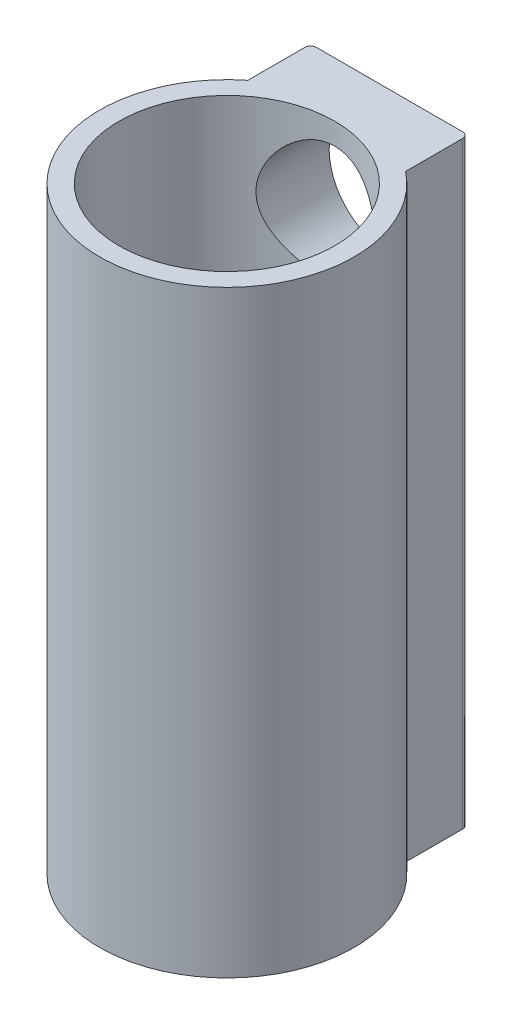
from build123d import *

# Parameters (mm, degrees)
BOSS_EXTRUDE1_DEPTH     = 18.57
SKETCH2_R               = 3.35
CUT_EXTRUDE1_DEPTH      = 18.57
CUT_EXTRUDE2_REACH      = 23.011
CUT_EXTRUDE2_END_RADIUS = 3.35
SKETCH3_R               = 1.875
FILLET1_R               = 0.18


with BuildPart() as part:
    # Sketch1 → Boss-Extrude1 (new body)
    with BuildSketch(Plane(origin=(0, 0, 0), x_dir=(1, 0, 0), z_dir=(0, 1, 0))):
        with BuildLine():
            Line((2.45, 3.098386677), (2.45, 5.05))
            Line((2.45, 5.05), (-2.45, 5.05))
            Line((-2.45, 5.05), (-2.45, 3.098386677))
            ThreePointArc((-2.45, 3.098386677), (0, -3.95), (2.45, 3.098386677))
        make_face()
    extrude(amount=BOSS_EXTRUDE1_DEPTH)

    # Sketch2 → Cut-Extrude1 (cut)
    with BuildSketch(Plane.XZ):
        with Locations(Location((0, 0, 0), (0, 0, 270))):
            Circle(SKETCH2_R)
    extrude(amount=-CUT_EXTRUDE1_DEPTH, mode=Mode.SUBTRACT)

    # Cut-Extrude2: up to this cylinder (the profile starts outside it)
    cut_extrude2_end = Plane(origin=(0, 9.55, 0), z_dir=(0, -1, 0)) * Cylinder(CUT_EXTRUDE2_END_RADIUS, 66.672, mode=Mode.PRIVATE)
    # Sketch3 → Cut-Extrude2 (cut, up to the surface)
    with BuildSketch(Plane(origin=(0, 0, -5.05), x_dir=(-1, 0, 0), z_dir=(0, 0, -1)), mode=Mode.PRIVATE) as cut_extrude2_sk1:
        with Locations((0, 16.025)):
            Circle(SKETCH3_R)
    cut_extrude2_tool1 = extrude(cut_extrude2_sk1.sketch, amount=-CUT_EXTRUDE2_REACH, mode=Mode.PRIVATE) - cut_extrude2_end
    add(cut_extrude2_tool1.solids().sort_by_distance((0, 16.025, -5.05))[0], mode=Mode.SUBTRACT)
    # Sketch3 → Cut-Extrude2 (cut, up to the surface)
    with BuildSketch(Plane(origin=(0, 0, -5.05), x_dir=(-1, 0, 0), z_dir=(0, 0, -1)), mode=Mode.PRIVATE) as cut_extrude2_sk2:
        with Locations((0, 3.075)):
            Circle(SKETCH3_R)
    cut_extrude2_tool2 = extrude(cut_extrude2_sk2.sketch, amount=-CUT_EXTRUDE2_REACH, mode=Mode.PRIVATE) - cut_extrude2_end
    add(cut_extrude2_tool2.solids().sort_by_distance((0, 3.075, -5.05))[0], mode=Mode.SUBTRACT)

    # Fillet1
    fillet1_edges = [part.edges().sort_by_distance(p)[0] for p in [
        (-2.45, 9.285, -5.05),
        (2.45, 9.285, -5.05),
    ]]
    fillet(fillet1_edges, radius=FILLET1_R)


solid = part.part
